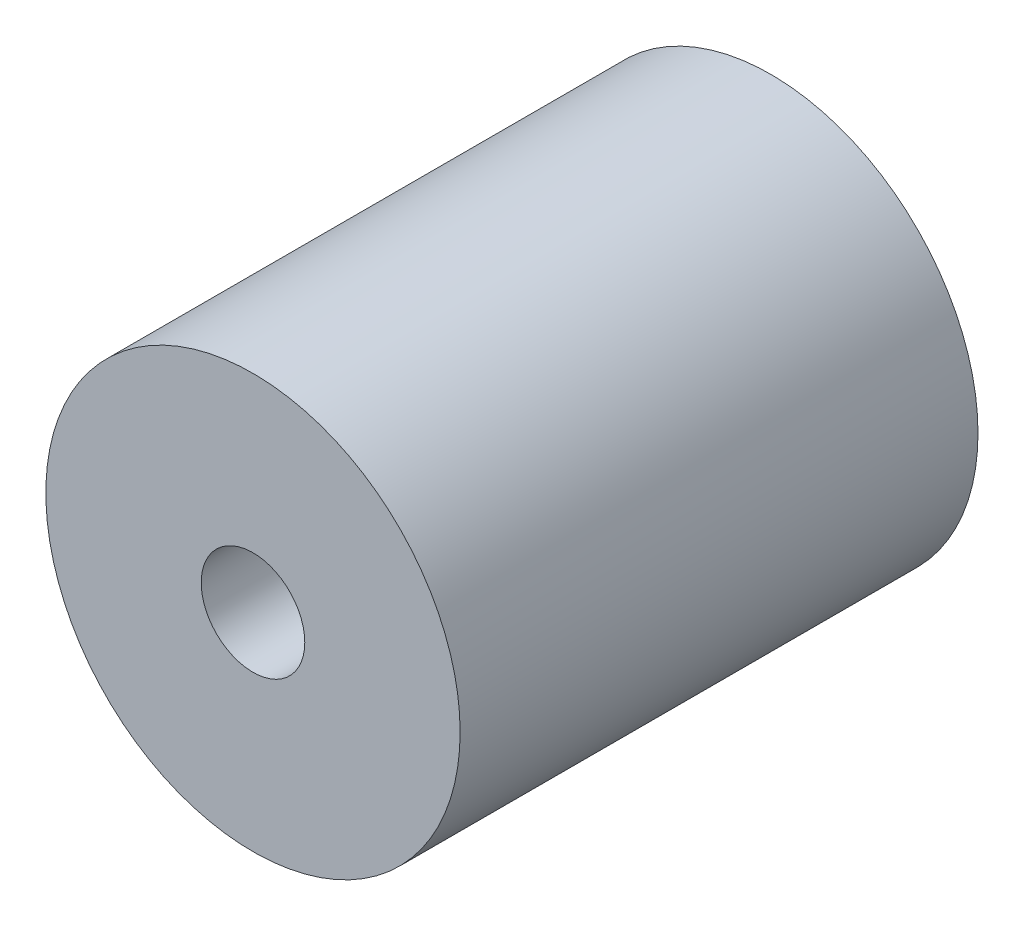
from build123d import *

# Parameters (mm, degrees)
SKETCH1_R           = 10
BOSS_EXTRUDE1_DEPTH = 25
SKETCH2_R           = 2.5
CUT_EXTRUDE1_DEPTH  = 6
SKETCH3_R           = 3.175
CUT_EXTRUDE2_DEPTH  = 6


with BuildPart() as part:
    # Sketch1 → Boss-Extrude1 (new body)
    with BuildSketch(Plane.XY):
        Circle(SKETCH1_R)
    extrude(amount=BOSS_EXTRUDE1_DEPTH)

    # Sketch2 → Cut-Extrude1 (cut)
    with BuildSketch(Plane.XY.offset(25)):
        Circle(SKETCH2_R)
    extrude(amount=-CUT_EXTRUDE1_DEPTH, mode=Mode.SUBTRACT)

    # Sketch3 → Cut-Extrude2 (cut)
    with BuildSketch(Plane(origin=(0, 0, 0), x_dir=(-1, 0, 0), z_dir=(0, 0, -1))):
        Circle(SKETCH3_R)
    extrude(amount=-CUT_EXTRUDE2_DEPTH, mode=Mode.SUBTRACT)


solid = part.part
